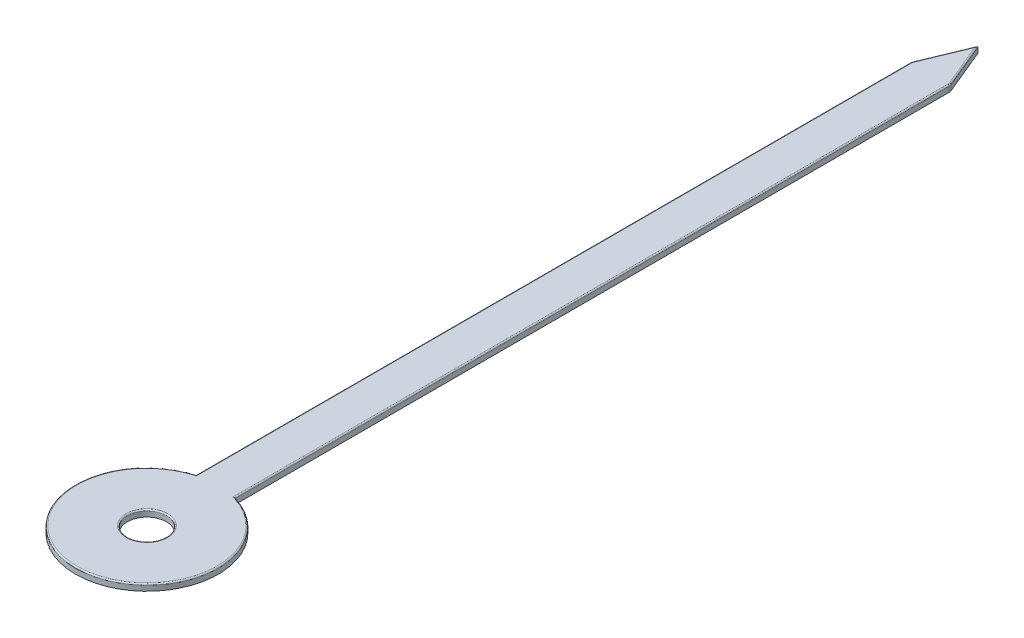
from build123d import *

# Parameters (mm, degrees)
SKETCH_1_R      = 0.3
EXTRUDE_1_DEPTH = 0.1
FILLET_1_R      = 0.1
FILLET_2_R      = 0.02


with BuildPart() as part:
    # 草图1 → 凸台-拉伸1 (new body)
    with BuildSketch(Plane(origin=(0, 0, 0), x_dir=(1, 0, 0), z_dir=(0, 1, 0))):
        with BuildLine():
            Line((0.3, 1.058300524), (0.3, 12.075735931))
            Line((0.3, 12.075735931), (0, 12.8))
            Line((0, 12.8), (-0.3, 12.075735931))
            Line((-0.3, 12.075735931), (-0.3, 1.058300524))
            ThreePointArc((-0.3, 1.058300524), (0, -1.1), (0.3, 1.058300524))
        make_face()
        with Locations(Location((0, 0, 0), (0, 0, 270))):
            Circle(SKETCH_1_R, mode=Mode.SUBTRACT)
    extrude(amount=EXTRUDE_1_DEPTH)

    # 圆角1
    fillet_1_edges = [part.edges().sort_by_distance(p)[0] for p in [
        (0.3, 0.05, -12.075735931),
        (-0.3, 0.05, -12.075735931),
    ]]
    fillet(fillet_1_edges, radius=FILLET_1_R)

    # 圆角2
    fillet_2_edges = [part.edges().sort_by_distance(p)[0] for p in [
        (0.3, 0.1, -6.557072609),
        (0.298078528, 0.1, -12.075353727),
        (0, 0.1, 1.1),
        (0.146193977, 0.1, -12.447056519),
        (-0.3, 0.1, -6.557072609),
        (-0.146193977, 0.1, -12.447056519),
        (-0.298078528, 0.1, -12.075353727),
        (0, 0.1, -0.3),
    ]]
    fillet(fillet_2_edges, radius=FILLET_2_R)


solid = part.part
